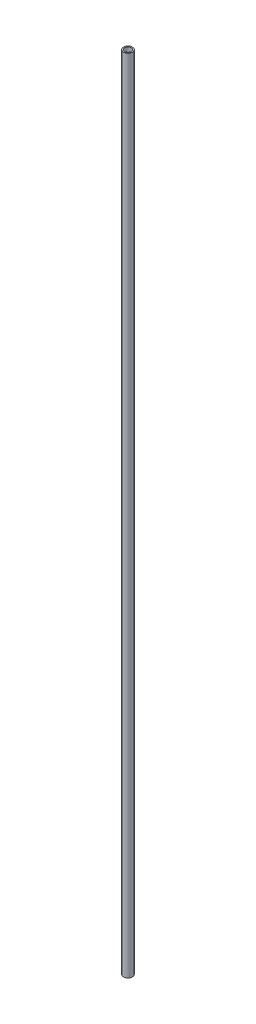
from build123d import *

# Parameters (mm, degrees)
SKETCH1_R           = 13
SKETCH1_R_2         = 9.525
BOSS_EXTRUDE1_DEPTH = 2339.34


with BuildPart() as part:
    # Sketch1 → Boss-Extrude1 (new body)
    with BuildSketch(Plane(origin=(0, 0, 0), x_dir=(1, 0, 0), z_dir=(0, 1, 0))):
        with Locations(Location((0, 0, 0), (0, 0, 270))):
            Circle(SKETCH1_R)
        with Locations(Location((0, 0, 0), (0, 0, 270))):
            Circle(SKETCH1_R_2, mode=Mode.SUBTRACT)
    extrude(amount=BOSS_EXTRUDE1_DEPTH)


solid = part.part
